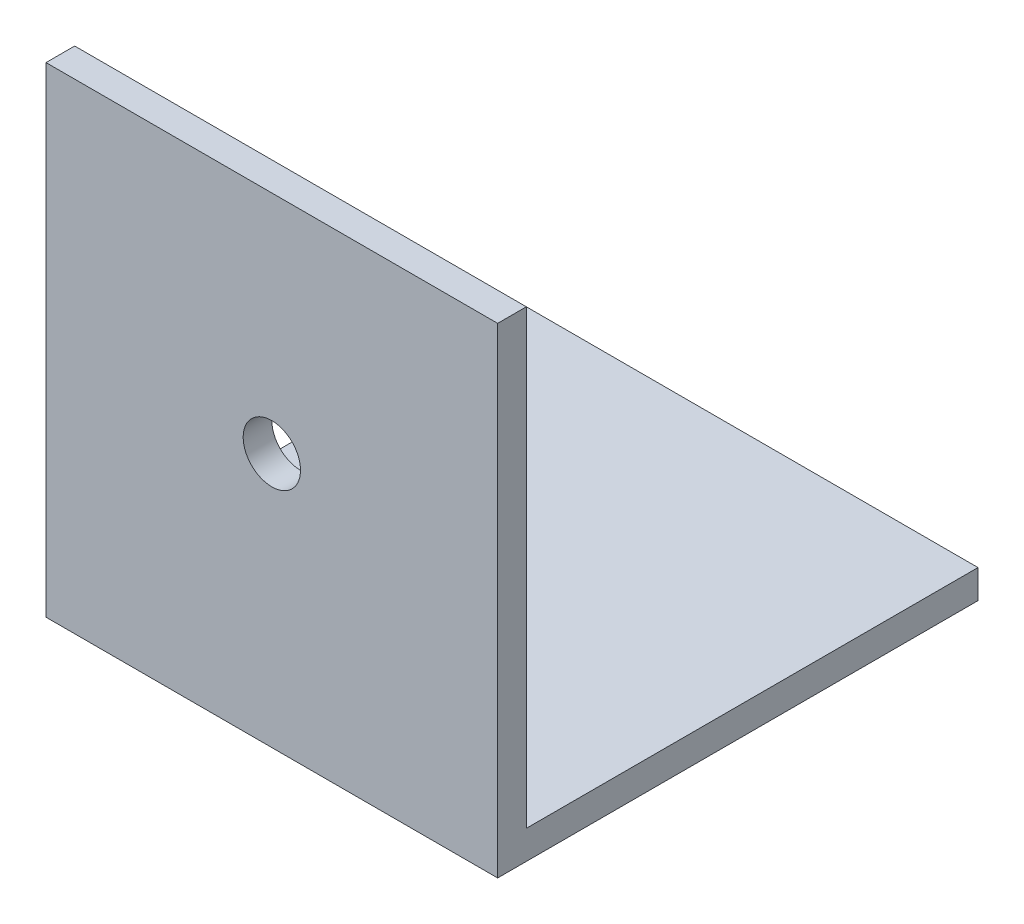
from build123d import *

# Parameters (mm, degrees)
BOSS_EXTRUDE1_DEPTH      = 50
BOSS_EXTRUDE1_DEPTH_BACK = 50
CUT_EXTRUDE1_DEPTH       = 50
CUT_EXTRUDE1_DEPTH_BACK  = 50
SKETCH2_R                = 6.35


with BuildPart() as part:
    # Sketch1 → Boss-Extrude1 (new, two sides: drawn at the far end of the back side and taken through both)
    with BuildSketch(Plane(origin=(0, 0, 0), x_dir=(0, 0, -1), z_dir=(1, 0, 0)).offset(-BOSS_EXTRUDE1_DEPTH_BACK)):
        Polygon((0, 0), (0, 100), (-6.35, 100), (-6.35, -6.35), (100, -6.35), (100, 0), align=None)
    extrude(amount=BOSS_EXTRUDE1_DEPTH + BOSS_EXTRUDE1_DEPTH_BACK)

    # Sketch2 → Cut-Extrude1 (cut, two sides: drawn at the far end of the back side and taken through both)
    with BuildSketch(Plane.XY.offset(-CUT_EXTRUDE1_DEPTH_BACK)):
        with Locations((0, 50)):
            Circle(SKETCH2_R)
    extrude(amount=CUT_EXTRUDE1_DEPTH + CUT_EXTRUDE1_DEPTH_BACK, mode=Mode.SUBTRACT)


solid = part.part
